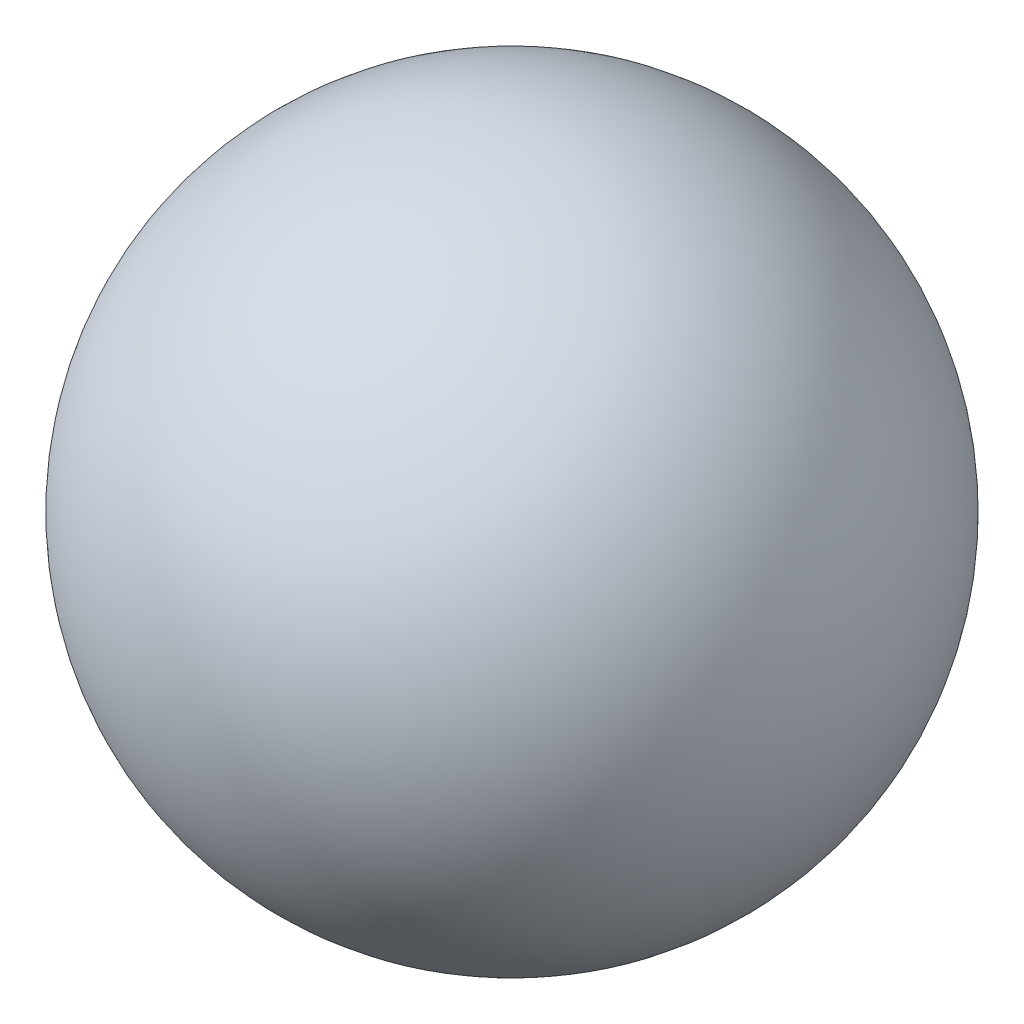
from build123d import *


with BuildPart() as part:
    # 草图1 → 旋转1 (revolve)
    with BuildSketch(Plane.XY):
        with BuildLine():
            Line((0, 12), (0, -12))
            ThreePointArc((0, -12), (12, 0), (0, 12))
        make_face()
    revolve(axis=Axis((0, 0, 0), (0, 1, 0)))


solid = part.part
